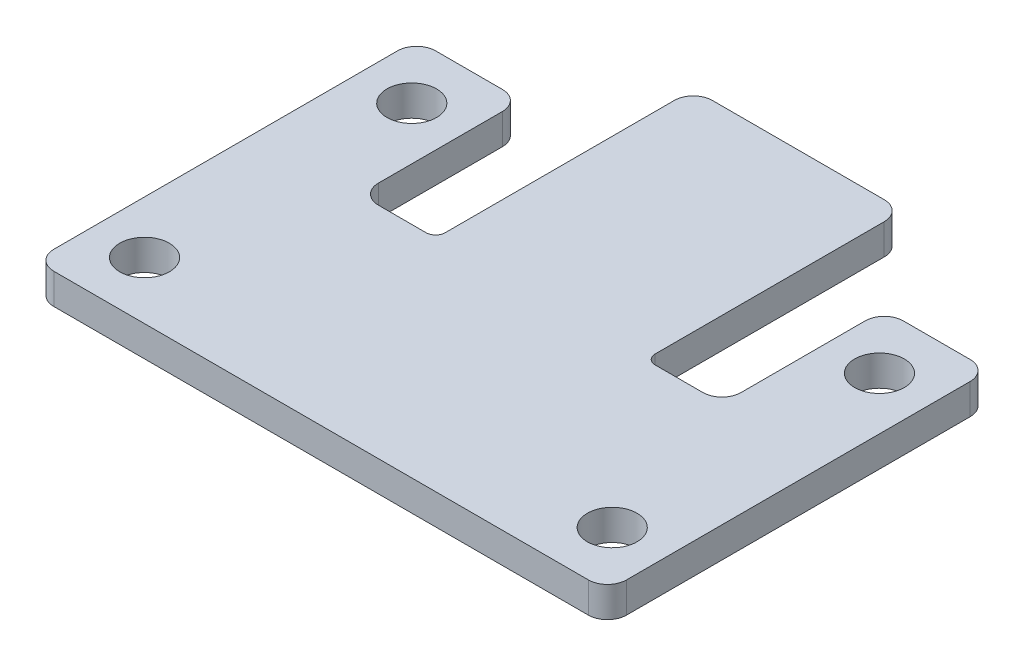
from build123d import *

# Parameters (mm, degrees)
BOSS_EXTRUDE1_DEPTH      = 1.6
FILLET1_R                = 1
M2_CLEARANCE_HOLE1_D     = 2.6
M2_CLEARANCE_HOLE1_DEPTH = 1.6
M2_CLEARANCE_HOLE1_TIP   = 0.781118805
FILLET2_R                = 0.5


with BuildPart() as part:
    # Sketch1 → Boss-Extrude1 (new body)
    with BuildSketch(Plane(origin=(0, 0, 0), x_dir=(1, 0, 0), z_dir=(0, 1, 0))):
        Polygon((-15, 20), (-15, 0), (15, 0), (15, 20), (9.5, 20), (9.5, 11.5), (5.5, 11.5), (5.5, 25), (-5.5, 25), (-5.5, 11.5), (-9.5, 11.5), (-9.5, 20), align=None)
    extrude(amount=BOSS_EXTRUDE1_DEPTH)

    # Fillet1
    fillet1_edges = [part.edges().sort_by_distance(p)[0] for p in [
        (-9.5, 0.8, -20),
        (-9.5, 0.8, -11.5),
        (-5.5, 0.8, -25),
        (5.5, 0.8, -25),
        (9.5, 0.8, -11.5),
        (9.5, 0.8, -20),
        (15, 0.8, -20),
        (15, 0.8, 0),
        (-15, 0.8, 0),
        (-15, 0.8, -20),
    ]]
    fillet(fillet1_edges, radius=FILLET1_R)

    # M2 Clearance Hole1
    with Locations(Plane(origin=(0, 1.6, 0), x_dir=(1, 0, 0), z_dir=(0, 1, 0))):
        with Locations((-12.25, 17), (-12.25, 3), (12.25, 3), (12.25, 17)):
            Hole(M2_CLEARANCE_HOLE1_D / 2, depth=M2_CLEARANCE_HOLE1_DEPTH)
            with Locations((0, 0, -(M2_CLEARANCE_HOLE1_DEPTH + M2_CLEARANCE_HOLE1_TIP / 2))):  # 118° drill point
                Cone(0, M2_CLEARANCE_HOLE1_D / 2, M2_CLEARANCE_HOLE1_TIP, mode=Mode.SUBTRACT)

    # Fillet2
    fillet2_edges = [part.edges().sort_by_distance(p)[0] for p in [
        (-5.5, 0.8, -11.5),
        (5.5, 0.8, -11.5),
    ]]
    fillet(fillet2_edges, radius=FILLET2_R)


solid = part.part
